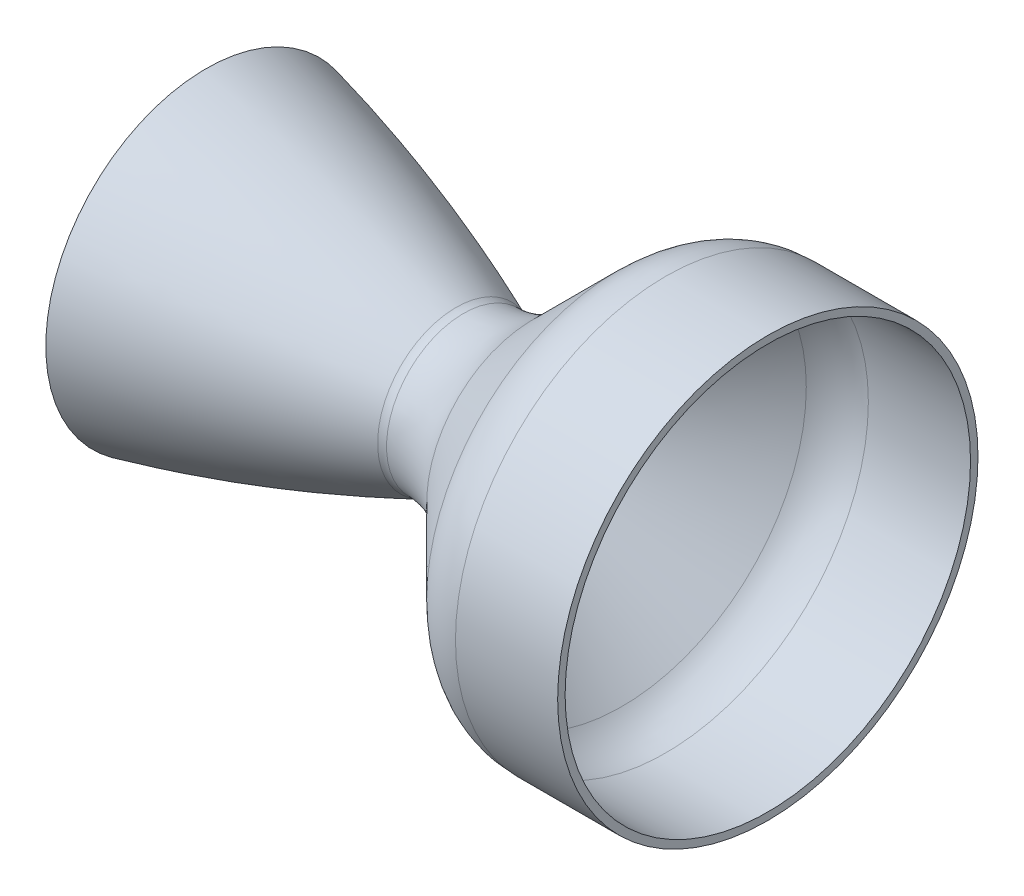
from build123d import *


with BuildPart() as part:
    # Sketch1 → Revolve1 (revolve)
    with BuildSketch(Plane.XY, mode=Mode.PRIVATE) as revolve1_sk:
        with BuildLine():
            Line((50.674568212, 32.653330611), (34.216224259, 32.653330611))
            ThreePointArc((34.216224259, 32.653330611), (30.389389936, 31.892125936), (27.145156447, 29.724398423))
            Line((27.145156447, 29.724398423), (13.5413641, 16.120606076))
            ThreePointArc((13.5413641, 16.120606076), (8.09105184, 12.478823854), (1.661970177, 11.2))
            ThreePointArc((1.661970177, 11.2), (0.814173455, 11.284839785), (0, 11.535994428))
            add(Edge.make_bspline(
                [(0, 11.535994428), (-19.935169187, 19.939913318), (-40.096604749, 24.629816077)],
                knots=[0, 0, 0, 1, 1, 1], degree=2))
            Line((-40.096604749, 24.629816077), (-39.824722735, 25.798610401))
            add(Edge.make_bspline(
                [(0.466147207, 12.641755153), (-19.559165394, 21.084071214), (-39.824722735, 25.798610401)],
                knots=[0, 0, 0, 1, 1, 1], degree=2))
            ThreePointArc((0.466147207, 12.641755153), (1.051962364, 12.461044034), (1.661970177, 12.4))
            ThreePointArc((1.661970177, 12.4), (7.631831721, 13.587479293), (12.692835963, 16.969134213))
            Line((12.692835963, 16.969134213), (26.29662831, 30.57292656))
            ThreePointArc((26.29662831, 30.57292656), (29.930169817, 33.000781375), (34.216224259, 33.853330611))
            Line((34.216224259, 33.853330611), (50.674568212, 33.853330611))
            Line((50.674568212, 33.853330611), (50.674568212, 32.653330611))
        make_face()
    revolve(revolve1_sk.sketch.rotate(Axis((0, 0, 0), (-1, 0, 0)), 90), axis=Axis((0, 0, 0), (-1, 0, 0)))


solid = part.part
